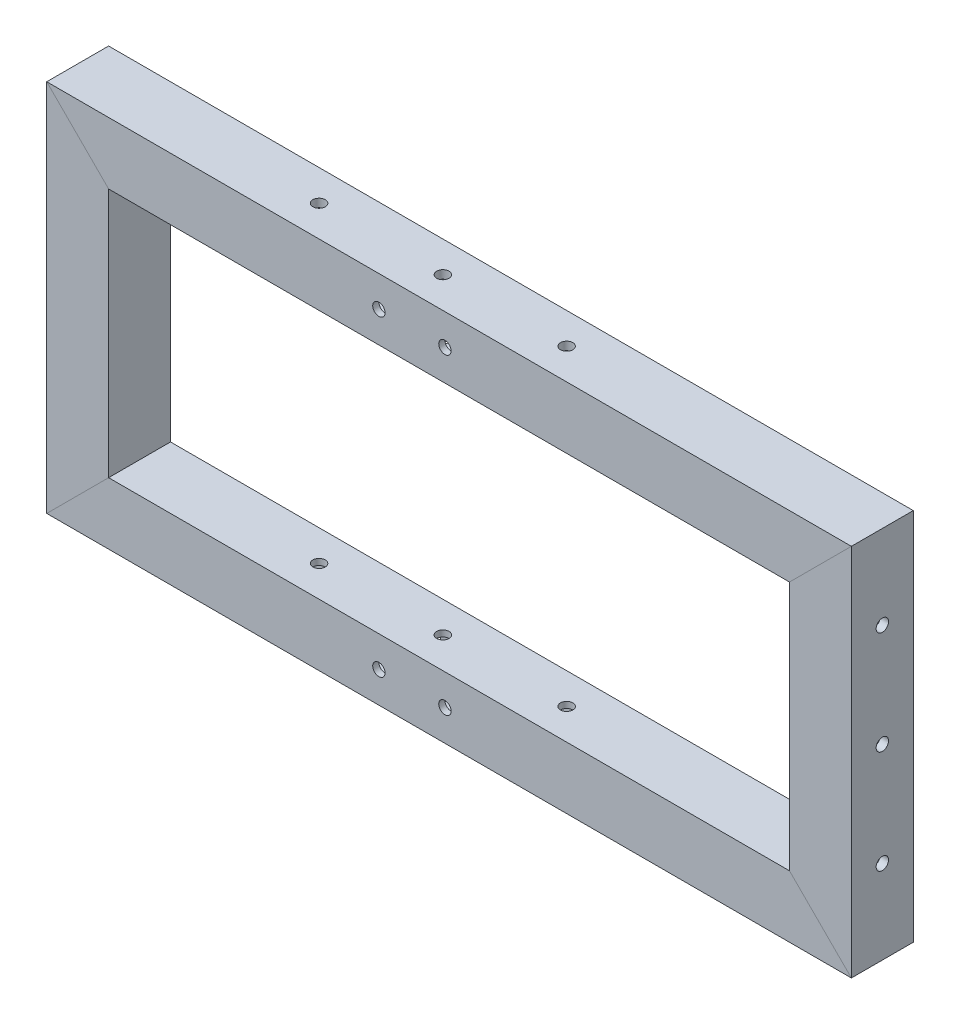
from build123d import *

# Parameters (mm, degrees)
MEMBER_15_15_1_5_1_DEPTH      = 87.206601718
MEMBER_15_15_1_5_1_DEPTH_BACK = 11.606601718
MEMBER_15_15_1_5_1_2_DEPTH    = 203.213203436
MEMBER_15_15_1_5_1_3_DEPTH    = 98.813203436
MEMBER_15_15_1_5_1_4_DEPTH    = 203.213203436
SKETCH_3_R                    = 1.5
CUT_EXTRUDE_1_DEPTH           = 209.376726148
SKETCH_4_R                    = 1.5
CUT_EXTRUDE_2_DEPTH           = 206.637691098
SKETCH_6_R                    = 1.5
CUT_EXTRUDE_3_DEPTH           = 15


with BuildPart() as part:
    # Sketch1 → Member 15 _15_ 1.5_1 (new, two sides: drawn at the far end of the back side and taken through both)
    with BuildSketch(Plane(origin=(0, 0, 0), x_dir=(1, 0, 0), z_dir=(0, 1, 0)).offset(-MEMBER_15_15_1_5_1_DEPTH_BACK)):
        Polygon((-6, -7.5), (6, -7.5), (7.5, -7.5), (7.5, -6), (7.5, 6), (7.5, 7.5), (6, 7.5), (-6, 7.5), (-7.5, 7.5), (-7.5, 6), (-7.5, -6), (-7.5, -7.5), align=None)
        Polygon((-4, -6), (4, -6), (6, -6), (6, -3.5), (6, 3.5), (6, 6), (3.5, 6), (-3.5, 6), (-5.5, 6), (-5.5, 3.5), (-5.5, -3.5), (-5.5, -6), align=None, mode=Mode.SUBTRACT)
    extrude(amount=MEMBER_15_15_1_5_1_DEPTH + MEMBER_15_15_1_5_1_DEPTH_BACK)

    # Member 15 _15_ 1.5_1 mitre 1
    split(bisect_by=Plane(origin=(0, 0, 0), x_dir=(-0.707106781, -0.707106781, 0), z_dir=(-0.707106781, 0.707106781, 0)), keep=Keep.TOP)

    # Member 15 _15_ 1.5_1 mitre 2
    split(bisect_by=Plane(origin=(0, 75.6, 0), x_dir=(0.707106781, -0.707106781, 0), z_dir=(-0.707106781, -0.707106781, 0)), keep=Keep.TOP)


with BuildPart() as body_2:
    # Sketch1 on segment 2 (carried to segment 2) → Member 15 _15_ 1.5_1 2 (new body)
    with BuildSketch(Plane(origin=(-11.606601718, 75.6, 0), x_dir=(0, -1, 0), z_dir=(1, 0, 0))):
        Polygon((-6, -7.5), (6, -7.5), (7.5, -7.5), (7.5, -6), (7.5, 6), (7.5, 7.5), (6, 7.5), (-6, 7.5), (-7.5, 7.5), (-7.5, 6), (-7.5, -6), (-7.5, -7.5), align=None)
        Polygon((-4, -6), (4, -6), (6, -6), (6, -3.5), (6, 3.5), (6, 6), (3.5, 6), (-3.5, 6), (-5.5, 6), (-5.5, 3.5), (-5.5, -3.5), (-5.5, -6), align=None, mode=Mode.SUBTRACT)
    extrude(amount=MEMBER_15_15_1_5_1_2_DEPTH)

    # Member 15 _15_ 1.5_1 2 mitre 1
    split(bisect_by=Plane(origin=(0, 75.6, 0), x_dir=(-0.707106781, 0.707106781, 0), z_dir=(0.707106781, 0.707106781, 0)), keep=Keep.TOP)

    # Member 15 _15_ 1.5_1 2 mitre 2
    split(bisect_by=Plane(origin=(180, 75.6, 0), x_dir=(-0.707106781, -0.707106781, 0), z_dir=(-0.707106781, 0.707106781, 0)), keep=Keep.TOP)


with BuildPart() as body_3:
    # Sketch1 on segment 3 (carried to segment 3) → Member 15 _15_ 1.5_1 3 (new body)
    with BuildSketch(Plane(origin=(180, 87.206601718, 0), x_dir=(-1, 0, 0), z_dir=(0, -1, 0))):
        Polygon((-6, -7.5), (6, -7.5), (7.5, -7.5), (7.5, -6), (7.5, 6), (7.5, 7.5), (6, 7.5), (-6, 7.5), (-7.5, 7.5), (-7.5, 6), (-7.5, -6), (-7.5, -7.5), align=None)
        Polygon((-4, -6), (4, -6), (6, -6), (6, -3.5), (6, 3.5), (6, 6), (3.5, 6), (-3.5, 6), (-5.5, 6), (-5.5, 3.5), (-5.5, -3.5), (-5.5, -6), align=None, mode=Mode.SUBTRACT)
    extrude(amount=MEMBER_15_15_1_5_1_3_DEPTH)

    # Member 15 _15_ 1.5_1 3 mitre 1
    split(bisect_by=Plane(origin=(180, 0, 0), x_dir=(-0.707106781, 0.707106781, 0), z_dir=(0.707106781, 0.707106781, 0)), keep=Keep.TOP)

    # Member 15 _15_ 1.5_1 3 mitre 2
    split(bisect_by=Plane(origin=(180, 75.6, 0), x_dir=(0.707106781, 0.707106781, 0), z_dir=(0.707106781, -0.707106781, 0)), keep=Keep.TOP)

    # 草图6 → 切除-拉伸3 (cut)
    with BuildSketch(Plane(origin=(187.5, 0, 0), x_dir=(0, 0, -1), z_dir=(1, 0, 0))):
        with Locations((0, 37.8)):
            Circle(SKETCH_6_R)
        with Locations((0, 12.8)):
            Circle(SKETCH_6_R)
        with Locations(Location((0, 62.8, 0), (0, 0, 180))):
            Circle(SKETCH_6_R)
    extrude(amount=-CUT_EXTRUDE_3_DEPTH, mode=Mode.SUBTRACT)


with BuildPart() as body_4:
    # Sketch1 on segment 4 (carried to segment 4) → Member 15 _15_ 1.5_1 4 (new body)
    with BuildSketch(Plane(origin=(191.606601718, 0, 0), x_dir=(0, 1, 0), z_dir=(-1, 0, 0))):
        Polygon((-6, -7.5), (6, -7.5), (7.5, -7.5), (7.5, -6), (7.5, 6), (7.5, 7.5), (6, 7.5), (-6, 7.5), (-7.5, 7.5), (-7.5, 6), (-7.5, -6), (-7.5, -7.5), align=None)
        Polygon((-4, -6), (4, -6), (6, -6), (6, -3.5), (6, 3.5), (6, 6), (3.5, 6), (-3.5, 6), (-5.5, 6), (-5.5, 3.5), (-5.5, -3.5), (-5.5, -6), align=None, mode=Mode.SUBTRACT)
    extrude(amount=MEMBER_15_15_1_5_1_4_DEPTH)

    # Member 15 _15_ 1.5_1 4 mitre 1
    split(bisect_by=Plane(origin=(0, 0, 0), x_dir=(0.707106781, 0.707106781, 0), z_dir=(0.707106781, -0.707106781, 0)), keep=Keep.TOP)

    # Member 15 _15_ 1.5_1 4 mitre 2
    split(bisect_by=Plane(origin=(180, 0, 0), x_dir=(0.707106781, -0.707106781, 0), z_dir=(-0.707106781, -0.707106781, 0)), keep=Keep.TOP)


with BuildPart() as cut_extrude_1_tool:
    # 草图3 → 切除-拉伸1 (new, through all)
    with BuildSketch(Plane.XZ.offset(7.5)):
        with Locations(Location((81, 0, 0), (0, 0, 270))):
            Circle(SKETCH_3_R)
        with Locations(Location((51, 0, 0), (0, 0, 270))):
            Circle(SKETCH_3_R)
        with Locations(Location((111, 0, 0), (0, 0, 90))):
            Circle(SKETCH_3_R)
    extrude(amount=-CUT_EXTRUDE_1_DEPTH)


with BuildPart() as body_2_1:
    add(body_2.part)

    # 切除-拉伸1: cut by cut_extrude_1_tool
    add(cut_extrude_1_tool.part, mode=Mode.SUBTRACT)


with BuildPart() as body_4_1:
    add(body_4.part)

    # 切除-拉伸1: cut by cut_extrude_1_tool
    add(cut_extrude_1_tool.part, mode=Mode.SUBTRACT)


with BuildPart() as cut_extrude_2_tool:
    # 草图4 → 切除-拉伸2 (new, through all)
    with BuildSketch(Plane.XY.offset(7.5)):
        with Locations((89, 0)):
            Circle(SKETCH_4_R)
        with Locations((73, 0)):
            Circle(SKETCH_4_R)
        with Locations(Location((73, 75.6, 0), (0, 0, 90))):
            Circle(SKETCH_4_R)
        with Locations(Location((89, 75.6, 0), (0, 0, 90))):
            Circle(SKETCH_4_R)
    extrude(amount=-CUT_EXTRUDE_2_DEPTH)


with BuildPart() as body_2_2:
    add(body_2_1.part)

    # 切除-拉伸2: cut by cut_extrude_2_tool
    add(cut_extrude_2_tool.part, mode=Mode.SUBTRACT)


with BuildPart() as body_4_2:
    add(body_4_1.part)

    # 切除-拉伸2: cut by cut_extrude_2_tool
    add(cut_extrude_2_tool.part, mode=Mode.SUBTRACT)


solid = Compound([part.part, body_3.part, body_2_2.part, body_4_2.part])
